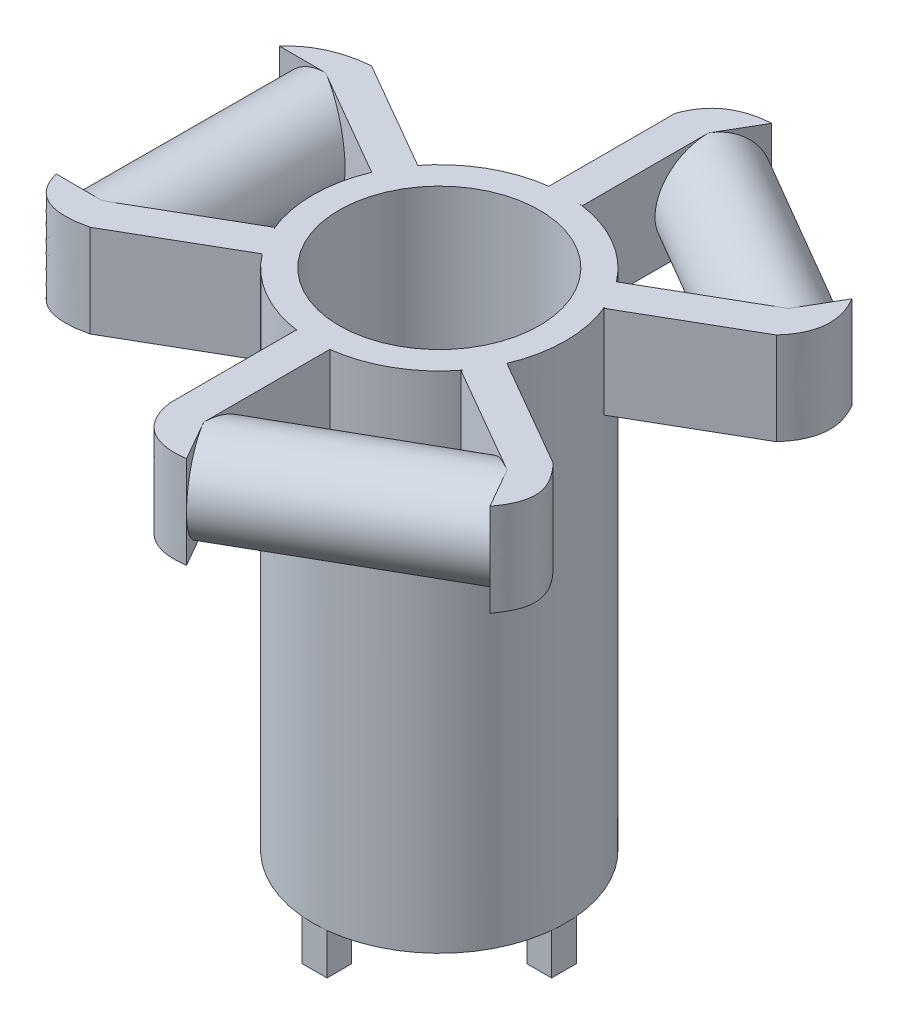
from build123d import *

# Parameters (mm, degrees)
SKETCH1_R            = 7.518485851
BOSS_EXTRUDE1_DEPTH  = 30
SKETCH7_R            = 5.956950852
CUT_EXTRUDE1_DEPTH   = 60
SKETCH8_W            = 2
SKETCH8_H            = 7.5
BOSS_EXTRUDE4_DEPTH  = 5.5
CIRPATTERN7_COUNT    = 6
SKETCH13_W           = 13.226989642
SKETCH13_H           = 2.75
BOSS_EXTRUDE6_DEPTH  = 5.5
BOSS_EXTRUDE7_DEPTH  = 5.516040115
CIRPATTERN10_COUNT   = 3
BOSS_EXTRUDE8_DEPTH  = 5.5
BOSS_EXTRUDE11_DEPTH = 5.5
BOSS_EXTRUDE12_DEPTH = 5.5
BOSS_EXTRUDE13_DEPTH = 5.5
SKETCH30_W           = 1.493482136
SKETCH30_H           = 1.466135263
BOSS_EXTRUDE15_DEPTH = 2.5
CIRPATTERN11_COUNT   = 4


with BuildPart() as part:
    # Sketch1 → Boss-Extrude1 (new body)
    with BuildSketch(Plane(origin=(0, 0, 0), x_dir=(1, 0, 0), z_dir=(0, 1, 0))):
        with Locations(Location((0, 0, 0), (0, 0, 270))):
            Circle(SKETCH1_R)
    extrude(amount=BOSS_EXTRUDE1_DEPTH)

    # Sketch7 → Cut-Extrude1 (cut)
    with BuildSketch(Plane(origin=(0, 30, 0), x_dir=(1, 0, 0), z_dir=(0, 1, 0))):
        with Locations(Location((0, 0, 0), (0, 0, 270))):
            Circle(SKETCH7_R)
    extrude(amount=-CUT_EXTRUDE1_DEPTH, mode=Mode.SUBTRACT)

    # Sketch8 → Boss-Extrude4 (add)
    with BuildSketch(Plane(origin=(0, 30, 0), x_dir=(1, 0, 0), z_dir=(0, 1, 0))):
        with Locations((0.055499062, 11.208924015)):
            Rectangle(SKETCH8_W, SKETCH8_H)
    boss_extrude4 = extrude(amount=-BOSS_EXTRUDE4_DEPTH)

    # CirPattern7: Boss-Extrude4 ×6 about axis
    cirpattern7_axis = Axis((0, 0, 0), (0, 1, 0))
    for i in range(1, CIRPATTERN7_COUNT):
        add(boss_extrude4.rotate(cirpattern7_axis, i * 360 / CIRPATTERN7_COUNT))

    # Sketch13 → Revolve1 (revolve)
    with BuildSketch(Plane(origin=(6.678494764, 0, 11.680402876), x_dir=(-0.8681157278989303, 0, 0.4963618468159196), z_dir=(-0.49636184681591955, 0, -0.8681157278989302))):
        with Locations((-0.00839179, 28.625)):
            Rectangle(SKETCH13_W, SKETCH13_H)
    revolve1 = revolve(axis=Axis((0.944500938, 27.25, 14.958924015), (0.8681157278989303, 0, -0.4963618468159195)))

    # Sketch15 → Boss-Extrude6 (add)
    with BuildSketch(Plane(origin=(0, 30, 0), x_dir=(1, 0, 0), z_dir=(0, 1, 0))):
        with BuildLine():
            Line((2.309496017, -17.346242267), (0.944500938, -14.958924015))
            Line((0.944500938, -14.958924015), (-1.055499062, -14.958924015))
            add(Edge.make_bspline(
                [(-1.055499062, -14.958924015), (-0.826479447, -16.658649969), (0.315527094, -17.640821071), (2.309496017, -17.346242267)],
                knots=[0, 0, 0, 0, 1, 1, 1, 1], degree=3))
        make_face()
    extrude(amount=-BOSS_EXTRUDE6_DEPTH)

    # Sketch20 → Boss-Extrude7 (add)
    with BuildSketch(Plane(origin=(0, 30, 0), x_dir=(1, 0, 0), z_dir=(0, 1, 0))):
        with BuildLine():
            Line((13.792053758, -10.78086926), (12.42705868, -8.393551008))
            Line((12.42705868, -8.393551008), (13.42705868, -6.661500201))
            add(Edge.make_bspline(
                [(13.42705868, -6.661500201), (14.923928961, -8.195328029), (14.840637873, -9.355950273), (13.792053758, -10.78086926)],
                knots=[0, 0, 0, 0, 1, 1, 1, 1], degree=3))
        make_face()
    extrude(amount=-BOSS_EXTRUDE7_DEPTH)

    # CirPattern10: Revolve1 ×3 about axis
    cirpattern10_axis = Axis((0, -30, 0), (0, 1, 0))
    for i in range(1, CIRPATTERN10_COUNT):
        add(revolve1.rotate(cirpattern10_axis, i * 360 / CIRPATTERN10_COUNT))

    # Sketch21 → Boss-Extrude8 (add)
    with BuildSketch(Plane(origin=(0, 30, 0), x_dir=(1, 0, 0), z_dir=(0, 1, 0))):
        with BuildLine():
            Line((-16.232533533, -6.553834295), (-13.482557741, -6.565373007))
            Line((-13.482557741, -6.565373007), (-12.482557741, -8.297423814))
            add(Edge.make_bspline(
                [(-12.482557741, -8.297423814), (-15.604680205, -9.03295077), (-16.232533533, -6.553834295)],
                knots=[0, 0, 0, 1, 1, 1], degree=2))
        make_face()
    extrude(amount=-BOSS_EXTRUDE8_DEPTH)

    # Sketch24 → Boss-Extrude11 (add)
    with BuildSketch(Plane(origin=(0, 30, 0), x_dir=(1, 0, 0), z_dir=(0, 1, 0))):
        with BuildLine():
            Line((-13.42705868, 6.661500201), (-16.177034472, 6.673038913))
            add(Edge.make_bspline(
                [(-12.42705868, 8.393551008), (-14.838115801, 8.181475497), (-16.177034472, 6.673038913)],
                knots=[0, 0, 0, 1, 1, 1], degree=2))
            Line((-12.42705868, 8.393551008), (-13.42705868, 6.661500201))
        make_face()
    extrude(amount=-BOSS_EXTRUDE11_DEPTH)

    # Sketch26 → Boss-Extrude12 (add)
    with BuildSketch(Plane(origin=(0, 30, 0), x_dir=(1, 0, 0), z_dir=(0, 1, 0))):
        with BuildLine():
            Line((13.867538455, 10.673203354), (12.482557741, 8.297423814))
            Line((12.482557741, 8.297423814), (13.482557741, 6.565373007))
            add(Edge.make_bspline(
                [(13.482557741, 6.565373007), (15.18756028, 8.443349852), (13.867538455, 10.673203354)],
                knots=[0, 0, 0, 1, 1, 1], degree=2))
        make_face()
    extrude(amount=-BOSS_EXTRUDE12_DEPTH)

    # Sketch27 → Boss-Extrude13 (add)
    with BuildSketch(Plane(origin=(0, 30, 0), x_dir=(1, 0, 0), z_dir=(0, 1, 0))):
        with BuildLine():
            Line((-0.944500938, 14.958924015), (1.055499062, 14.958924015))
            Line((1.055499062, 14.958924015), (2.440479775, 17.334703555))
            add(Edge.make_bspline(
                [(-0.944500938, 14.958924015), (-0.189537041, 17.173381249), (2.440479775, 17.334703555)],
                knots=[0, 0, 0, 1, 1, 1], degree=2))
        make_face()
    extrude(amount=-BOSS_EXTRUDE13_DEPTH)

    # Sketch30 → Boss-Extrude15 (add)
    with BuildSketch(Plane(origin=(0, 0, 0), x_dir=(-1, 0, 0), z_dir=(0, -1, 0))):
        with Locations((0, -6.69246192)):
            Rectangle(SKETCH30_W, SKETCH30_H)
    boss_extrude15 = extrude(amount=BOSS_EXTRUDE15_DEPTH)

    # CirPattern11: Boss-Extrude15 ×4 about axis
    cirpattern11_axis = Axis((0, 0, 0), (0, 1, 0))
    for i in range(1, CIRPATTERN11_COUNT):
        add(boss_extrude15.rotate(cirpattern11_axis, i * 360 / CIRPATTERN11_COUNT))


solid = part.part
